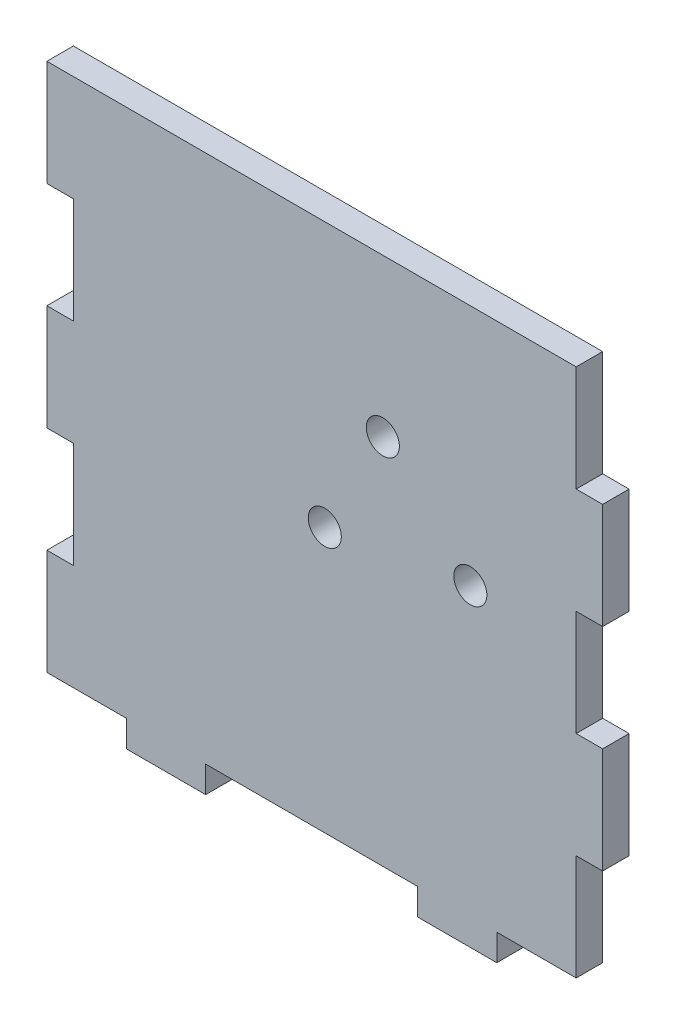
from build123d import *

# Parameters (mm, degrees)
BOXSIDE_DEPTH      = 6.35
SKETCH2_R          = 3.96875
CUT_EXTRUDE1_DEPTH = 99.986703653


with BuildPart() as part:
    # Sketch1 → BOXSIDE (new body)
    with BuildSketch(Plane.XY):
        Polygon((-63.5, 38.1), (-63.5, 63.5), (63.5, 63.5), (63.5, 38.1), (69.85, 38.1), (69.85, 12.7), (63.5, 12.7), (63.5, -12.7), (69.85, -12.7), (69.85, -38.1), (63.5, -38.1), (63.5, -63.5), (44.45, -63.5), (44.45, -69.85), (25.4, -69.85), (25.4, -63.5), (-25.4, -63.5), (-25.4, -69.85), (-44.45, -69.85), (-44.45, -63.5), (-63.5, -63.5), (-63.5, -38.1), (-57.15, -38.1), (-57.15, -12.7), (-63.5, -12.7), (-63.5, 12.7), (-57.15, 12.7), (-57.15, 38.1), align=None)
    extrude(amount=BOXSIDE_DEPTH)

    # Sketch2 → Cut-Extrude1 (cut, through all)
    with BuildSketch(Plane.XY.offset(6.35)):
        with Locations((3.175, 0)):
            Circle(SKETCH2_R)
        with Locations((38.1, 5.339056325)):
            Circle(SKETCH2_R)
        with Locations((17.105250883, 25.77544668)):
            Circle(SKETCH2_R)
    extrude(amount=-CUT_EXTRUDE1_DEPTH, mode=Mode.SUBTRACT)


solid = part.part
